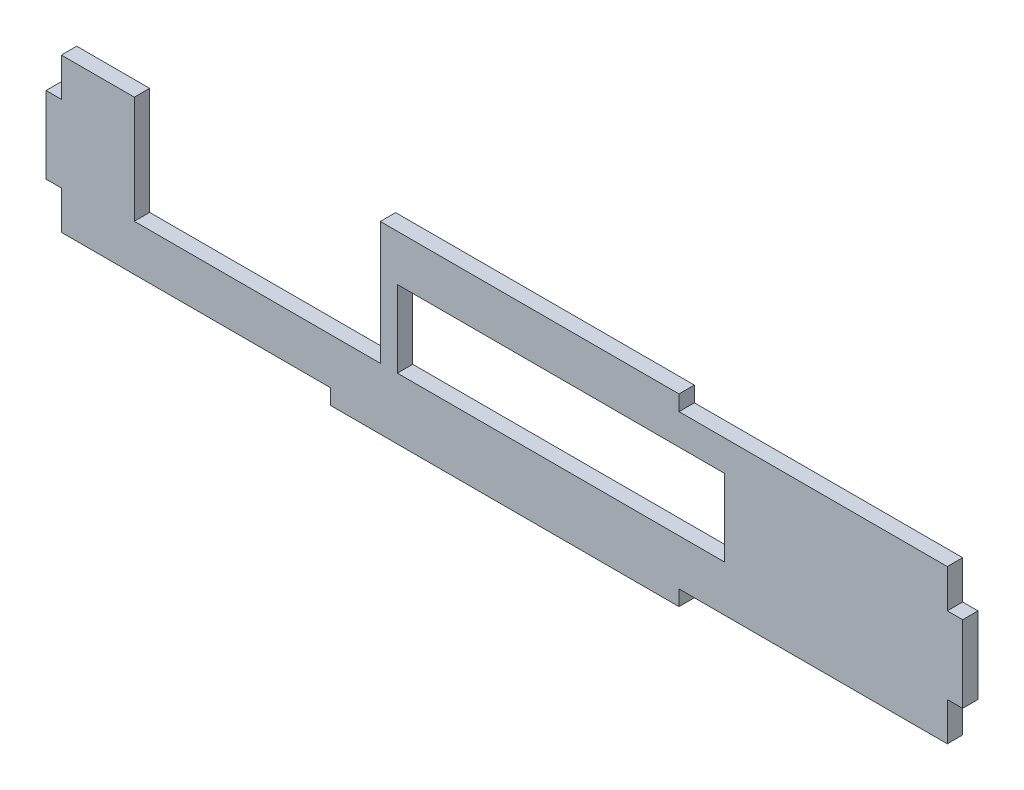
from build123d import *

# Parameters (mm, degrees)
SKETCH1_W           = 42.637682839
SKETCH1_H           = 10
BOSS_EXTRUDE1_DEPTH = 2


with BuildPart() as part:
    # Sketch1 → Boss-Extrude1 (new body)
    with BuildSketch(Plane.XY):
        Polygon((0, 20), (9.5, 20), (9.5, 5.999528404), (41.549837727, 5.999528404), (41.549837727, 20), (41.549837727, 22), (80.459837727, 22), (80.459837727, 20), (115.41, 20), (115.41, 15), (117.41, 15), (117.41, 5), (115.41, 5), (115.41, 0), (80.459837727, 0), (80.459837727, -2.000471596), (35.049837727, -2.000471596), (35.049837727, 0), (0, 0), (0, 5), (-2, 5), (-2, 15), (0, 15), align=None)
        with Locations((65.091158581, 11)):
            Rectangle(SKETCH1_W, SKETCH1_H, mode=Mode.SUBTRACT)
    extrude(amount=BOSS_EXTRUDE1_DEPTH)


solid = part.part
